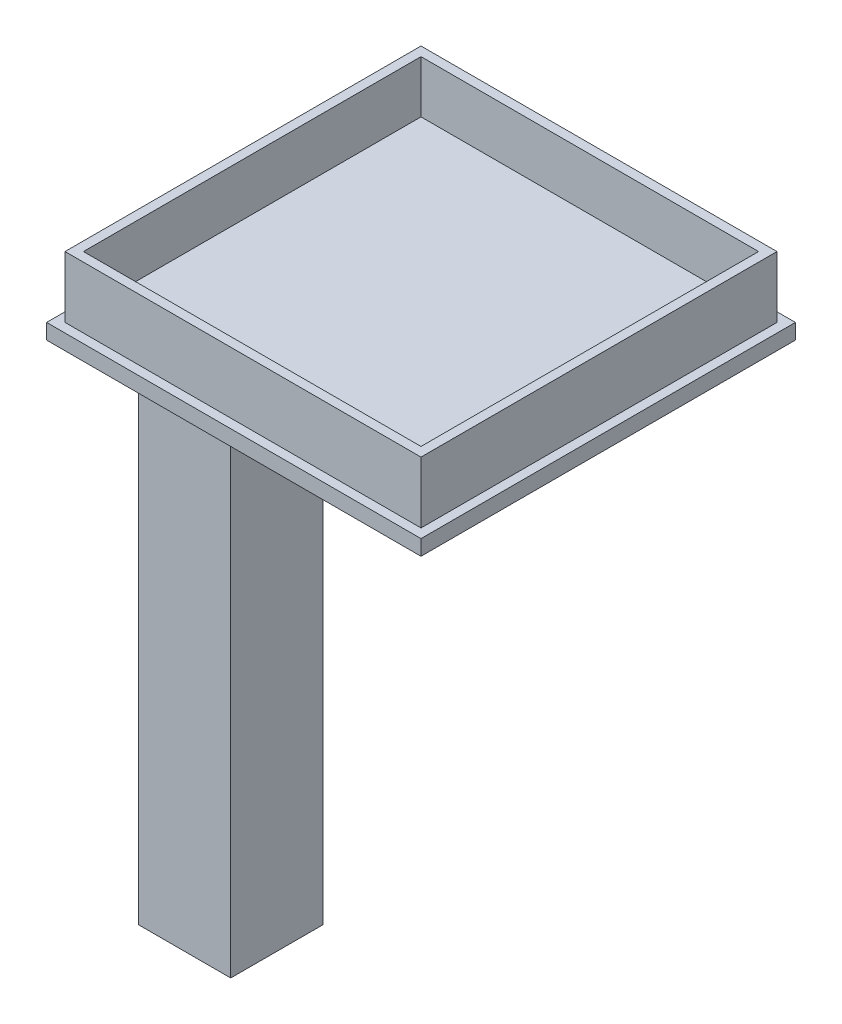
from build123d import *

# Parameters (mm, degrees)
SKETCH_1_W      = 116
SKETCH_1_H      = 116
EXTRUDE_1_DEPTH = 20
SHELL_1_T       = -3
SKETCH_2_W      = 122
SKETCH_2_H      = 122
EXTRUDE_2_DEPTH = 5
SKETCH_4_W      = 30
SKETCH_4_H      = 30
SKETCH_4_W_2    = 26
SKETCH_4_H_2    = 26
EXTRUDE_3_DEPTH = 165


with BuildPart() as part:
    # 草图1 → 凸台-拉伸1 (new body)
    with BuildSketch(Plane(origin=(0, 0, 0), x_dir=(1, 0, 0), z_dir=(0, 1, 0))):
        Rectangle(SKETCH_1_W, SKETCH_1_H)
    extrude(amount=EXTRUDE_1_DEPTH)

    # 抽壳1
    shell_1_openings = [part.faces().sort_by_distance(p)[0] for p in [
        (0, 20, 0),
    ]]
    offset(amount=SHELL_1_T, openings=shell_1_openings, kind=Kind.INTERSECTION)

    # 草图2 → 凸台-拉伸2 (add)
    with BuildSketch(Plane.XZ):
        Rectangle(SKETCH_2_W, SKETCH_2_H)
    extrude(amount=EXTRUDE_2_DEPTH)

    # 草图4 → 凸台-拉伸3 (add)
    with BuildSketch(Plane.XZ.offset(5)):
        with Locations((-31, 31)):
            Rectangle(SKETCH_4_W, SKETCH_4_H)
        with Locations((-31, 31)):
            Rectangle(SKETCH_4_W_2, SKETCH_4_H_2, mode=Mode.SUBTRACT)
    extrude(amount=EXTRUDE_3_DEPTH)


solid = part.part
